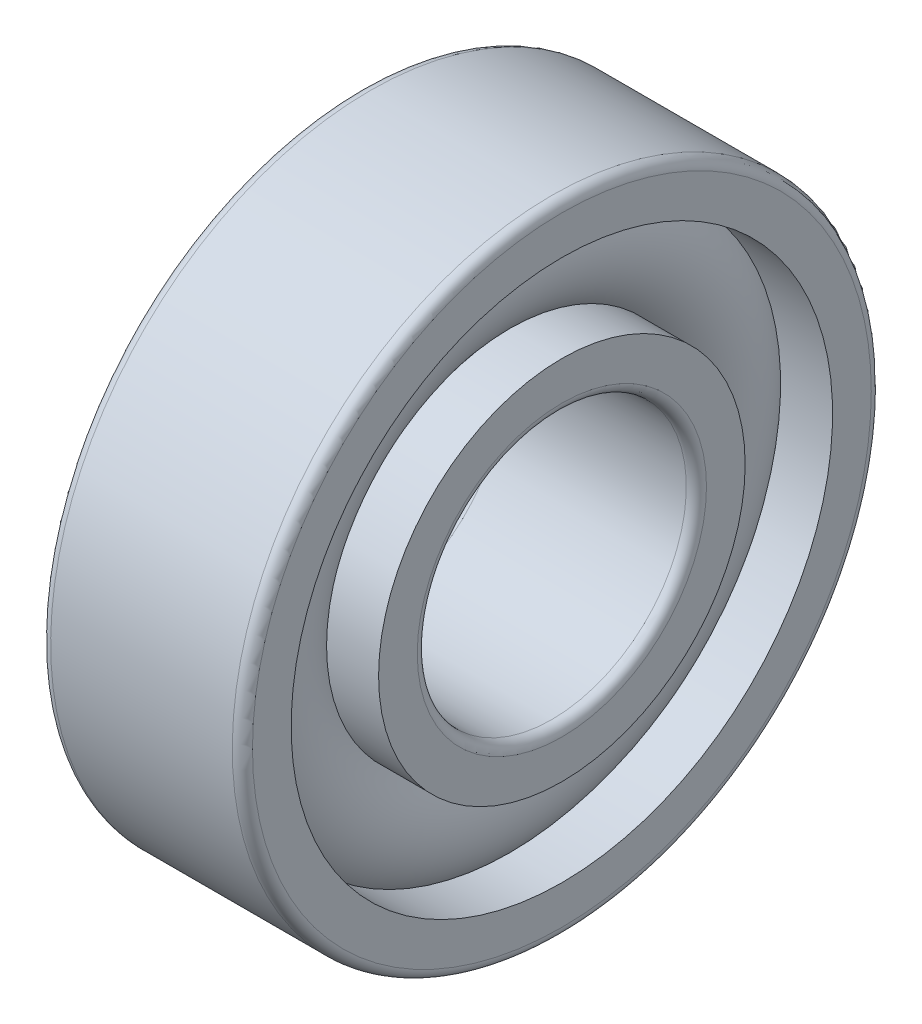
from build123d import *


with BuildPart() as part:
    # Esquisse1 → Révolution1 (revolve)
    with BuildSketch(Plane.XY.offset(-411.460370859)):
        with BuildLine():
            Line((-2.7, 4), (2.7, 4))
            ThreePointArc((2.7, 4), (2.912132034, 4.087867966), (3, 4.3))
            Line((3, 4.3), (3, 5.45))
            Line((3, 5.45), (1.453444185, 5.45))
            ThreePointArc((1.453444185, 5.45), (1.95, 6.75), (1.453444185, 8.05))
            Line((1.453444185, 8.05), (3, 8.05))
            Line((3, 8.05), (3, 9.2))
            ThreePointArc((3, 9.2), (2.912132034, 9.412132034), (2.7, 9.5))
            Line((2.7, 9.5), (-2.7, 9.5))
            ThreePointArc((-2.7, 9.5), (-2.912132034, 9.412132034), (-3, 9.2))
            Line((-3, 9.2), (-3, 8.05))
            Line((-3, 8.05), (-1.453444185, 8.05))
            ThreePointArc((-1.453444185, 8.05), (-1.95, 6.75), (-1.453444185, 5.45))
            Line((-1.453444185, 5.45), (-3, 5.45))
            Line((-3, 5.45), (-3, 4.3))
            ThreePointArc((-3, 4.3), (-2.912132034, 4.087867966), (-2.7, 4))
        make_face()
    revolve(axis=Axis((-3, 0, -411.460370859), (1, 0, 0)))


solid = part.part
